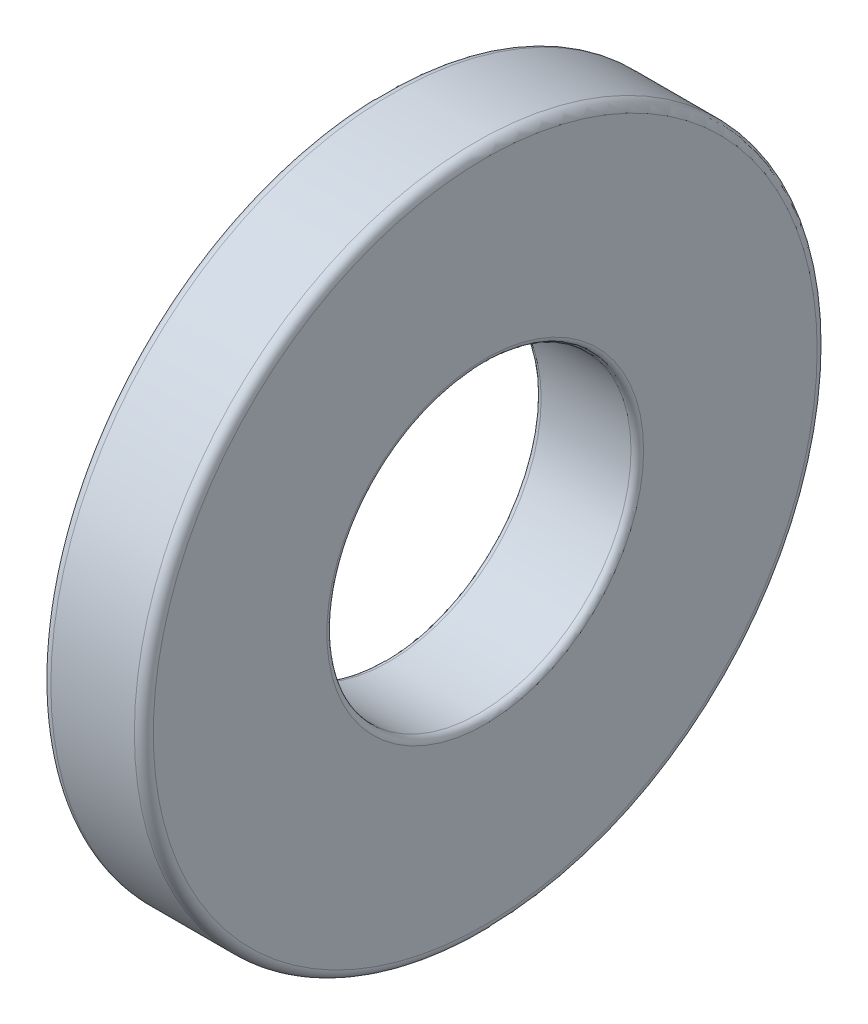
from build123d import *

# Parameters (mm, degrees)
SKETCH1_R           = 5.5
SKETCH1_R_2         = 2.45
BOSS_EXTRUDE1_DEPTH = 1.65
FILLET1_R           = 0.1524
FILLET2_R           = 0.1016


with BuildPart() as part:
    # Sketch1 → Boss-Extrude1 (new body)
    with BuildSketch(Plane(origin=(0, 0, 0), x_dir=(0, 0, -1), z_dir=(1, 0, 0))):
        Circle(SKETCH1_R)
        Circle(SKETCH1_R_2, mode=Mode.SUBTRACT)
    extrude(amount=BOSS_EXTRUDE1_DEPTH)

    # Fillet1
    fillet1_edges = [part.edges().sort_by_distance(p)[0] for p in [
        (0, 0, 5.5),
        (1.65, 0, 5.5),
    ]]
    fillet(fillet1_edges, radius=FILLET1_R)

    # Fillet2
    fillet2_edges = [part.edges().sort_by_distance(p)[0] for p in [
        (0, 0, 2.45),
        (1.65, 0, 2.45),
    ]]
    fillet(fillet2_edges, radius=FILLET2_R)


solid = part.part
